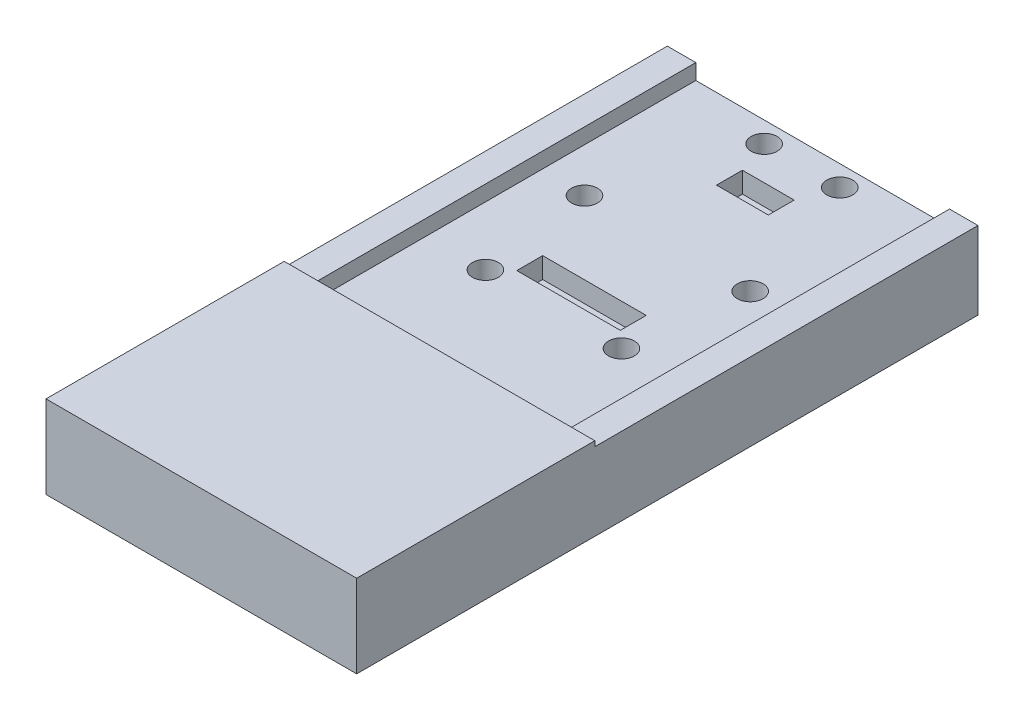
from build123d import *

# Parameters (mm, degrees)
SKETCH1_W           = 30
SKETCH1_H           = 60
SKETCH1_R           = 1.25
BOSS_EXTRUDE1_DEPTH = 6
SKETCH2_R           = 2.25
CUT_EXTRUDE1_DEPTH  = 2
SKETCH3_W           = 2.75
SKETCH3_H           = 60
BOSS_EXTRUDE2_DEPTH = 1.5
SKETCH4_R           = 1.25
SKETCH4_W           = 5
SKETCH4_H           = 2.5
SKETCH4_W_2         = 10
CUT_EXTRUDE2_DEPTH  = 2
SKETCH5_W           = 30
SKETCH5_H           = 23
BOSS_EXTRUDE3_DEPTH = 2


with BuildPart() as part:
    # Sketch1 → Boss-Extrude1 (new body)
    with BuildSketch(Plane(origin=(0, 0, 0), x_dir=(1, 0, 0), z_dir=(0, 1, 0))):
        Rectangle(SKETCH1_W, SKETCH1_H)
        with Locations(Location((-8, 15, 0), (0, 0, 270))):
            Circle(SKETCH1_R, mode=Mode.SUBTRACT)
        with Locations(Location((8, 15, 0), (0, 0, 270))):
            Circle(SKETCH1_R, mode=Mode.SUBTRACT)
    extrude(amount=-BOSS_EXTRUDE1_DEPTH)

    # Sketch2 → Cut-Extrude1 (cut)
    with BuildSketch(Plane(origin=(0, -6, 0), x_dir=(-1, 0, 0), z_dir=(0, -1, 0))):
        with Locations(Location((-8, 15, 0), (0, 0, 90))):
            Circle(SKETCH2_R)
        with Locations(Location((8, 15, 0), (0, 0, 90))):
            Circle(SKETCH2_R)
    extrude(amount=-CUT_EXTRUDE1_DEPTH, mode=Mode.SUBTRACT)

    # Sketch3 → Boss-Extrude2 (add)
    with BuildSketch(Plane(origin=(0, 0, 0), x_dir=(1, 0, 0), z_dir=(0, 1, 0))):
        with Locations((-13.625, 0)):
            Rectangle(SKETCH3_W, SKETCH3_H)
        with Locations((13.625, 0)):
            Rectangle(SKETCH3_W, SKETCH3_H)
    extrude(amount=BOSS_EXTRUDE2_DEPTH)

    # Sketch4 → Cut-Extrude2 (cut)
    with BuildSketch(Plane(origin=(0, 0, 0), x_dir=(1, 0, 0), z_dir=(0, 1, 0))):
        with Locations(Location((-3.65, 28, 0), (0, 0, 270))):
            Circle(SKETCH4_R)
        with Locations(Location((3.65, 28, 0), (0, 0, 270))):
            Circle(SKETCH4_R)
        with Locations(Location((-6.57, 4, 0), (0, 0, 270))):
            Circle(SKETCH4_R)
        with Locations(Location((6.57, 4, 0), (0, 0, 270))):
            Circle(SKETCH4_R)
        with Locations((0, 23.5)):
            Rectangle(SKETCH4_W, SKETCH4_H)
        with Locations((0, 6.71)):
            Rectangle(SKETCH4_W_2, SKETCH4_H)
    extrude(amount=-CUT_EXTRUDE2_DEPTH, mode=Mode.SUBTRACT)

    # Sketch5 → Boss-Extrude3 (add)
    with BuildSketch(Plane(origin=(0, 0, 0), x_dir=(1, 0, 0), z_dir=(0, 1, 0))):
        with Locations((0, -18.5)):
            Rectangle(SKETCH5_W, SKETCH5_H)
    extrude(amount=BOSS_EXTRUDE3_DEPTH)


solid = part.part
